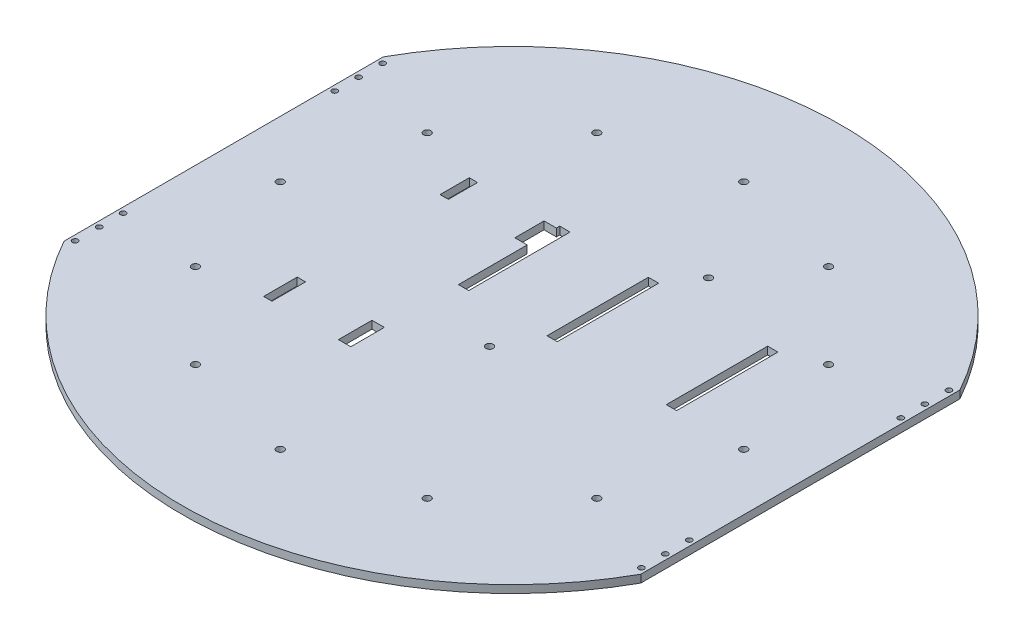
from build123d import *

# Parameters (mm, degrees)
BOSS_EXTRUDE1_DEPTH   = 4.7625
M3_CLEARANCE_HOLE1_D  = 3.4
F_8_CLEARANCE_HOLE1_D = 4.4958
CIRPATTERN1_COUNT     = 12
CUT_EXTRUDE1_REACH    = 272.048
SKETCH15_W            = 6.35
SKETCH15_H            = 62.484
SKETCH15_W_2          = 5.116657908
SKETCH15_H_2          = 18.000886741
SKETCH15_H_3          = 20.68418835
SKETCH15_W_3          = 7.62
CUT_EXTRUDE2_REACH    = 272.048
SKETCH17_R            = 2.2479


with BuildPart() as part:
    # Sketch1 → Boss-Extrude1 (new body)
    with BuildSketch(Plane(origin=(0, 0, 0), x_dir=(1, 0, 0), z_dir=(0, 1, 0))):
        with BuildLine():
            Line((177.8, 98.373776994), (177.8, -98.373776994))
            ThreePointArc((177.8, -98.373776994), (0, -203.2), (-177.8, -98.373776994))
            Line((-177.8, -98.373776994), (-177.8, 98.373776994))
            ThreePointArc((-177.8, 98.373776994), (0, 203.2), (177.8, 98.373776994))
        make_face()
    extrude(amount=BOSS_EXTRUDE1_DEPTH)

    # M3 Clearance Hole1 (through all)
    with Locations(Plane(origin=(0, 4.7625, 0), x_dir=(1, 0, 0), z_dir=(0, 1, 0))):
        with Locations((174.55, -94.8), (174.55, -80), (174.55, -65.2), (174.55, 65.2), (174.55, 80), (174.55, 94.8)):
            m3_clearance_hole1 = Hole(M3_CLEARANCE_HOLE1_D / 2)

    # Mirror1: M3 Clearance Hole1 across plane
    add(m3_clearance_hole1.mirror(Plane(origin=(0, 0, 0), x_dir=(0, 0, 1), z_dir=(1, 0, 0))), mode=Mode.SUBTRACT)

    # #8 Clearance Hole1 (through all)
    with Locations(Plane(origin=(0, 4.7625, 0), x_dir=(1, 0, 0), z_dir=(0, 1, 0))):
        with Locations((0, -142.875)):
            f_8_clearance_hole1 = Hole(F_8_CLEARANCE_HOLE1_D / 2)

    # CirPattern1: #8 Clearance Hole1 ×12 about axis
    cirpattern1_axis = Axis((0, 0, 0), (0, 1, 0))
    for i in range(1, CIRPATTERN1_COUNT):
        add(f_8_clearance_hole1.rotate(cirpattern1_axis, i * 360 / CIRPATTERN1_COUNT), mode=Mode.SUBTRACT)

    # Sketch15 → Cut-Extrude1 (cut, up to next)
    with BuildSketch(Plane(origin=(0, 4.7625, 0), x_dir=(1, 0, 0), z_dir=(0, 1, 0)), mode=Mode.PRIVATE) as cut_extrude1_sk1:
        with Locations((24.765, 31.242)):
            Rectangle(SKETCH15_W, SKETCH15_H)
    cut_extrude1_tool1 = extrude(cut_extrude1_sk1.sketch, amount=-CUT_EXTRUDE1_REACH, mode=Mode.PRIVATE) & part.part
    # Sketch15 → Cut-Extrude1 (cut, up to next)
    with BuildSketch(Plane(origin=(0, 4.7625, 0), x_dir=(1, 0, 0), z_dir=(0, 1, 0)), mode=Mode.PRIVATE) as cut_extrude1_sk2:
        Polygon((-26.67, 62.484), (-33.02, 62.484), (-33.02, 60.402879746), (-40.64, 60.402879746), (-40.64, 42.401993005), (-33.02, 42.401993005), (-33.02, 0), (-26.67, 0), align=None)
    cut_extrude1_tool2 = extrude(cut_extrude1_sk2.sketch, amount=-CUT_EXTRUDE1_REACH, mode=Mode.PRIVATE) & part.part
    # Sketch15 → Cut-Extrude1 (cut, up to next)
    with BuildSketch(Plane(origin=(0, 4.7625, 0), x_dir=(1, 0, 0), z_dir=(0, 1, 0)), mode=Mode.PRIVATE) as cut_extrude1_sk3:
        with Locations((98.3234, 31.242)):
            Rectangle(SKETCH15_W, SKETCH15_H)
    cut_extrude1_tool3 = extrude(cut_extrude1_sk3.sketch, amount=-CUT_EXTRUDE1_REACH, mode=Mode.PRIVATE) & part.part
    # Sketch15 → Cut-Extrude1 (cut, up to next)
    with BuildSketch(Plane(origin=(0, 4.7625, 0), x_dir=(1, 0, 0), z_dir=(0, 1, 0)), mode=Mode.PRIVATE) as cut_extrude1_sk4:
        with Locations((-84.198328954, 51.402436376)):
            Rectangle(SKETCH15_W_2, SKETCH15_H_2)
    cut_extrude1_tool4 = extrude(cut_extrude1_sk4.sketch, amount=-CUT_EXTRUDE1_REACH, mode=Mode.PRIVATE) & part.part
    # Sketch15 → Cut-Extrude1 (cut, up to next)
    with BuildSketch(Plane(origin=(0, 4.7625, 0), x_dir=(1, 0, 0), z_dir=(0, 1, 0)), mode=Mode.PRIVATE) as cut_extrude1_sk5:
        with Locations((-84.198328954, -56.013830848)):
            Rectangle(SKETCH15_W_2, SKETCH15_H_3)
    cut_extrude1_tool5 = extrude(cut_extrude1_sk5.sketch, amount=-CUT_EXTRUDE1_REACH, mode=Mode.PRIVATE) & part.part
    # Sketch15 → Cut-Extrude1 (cut, up to next)
    with BuildSketch(Plane(origin=(0, 4.7625, 0), x_dir=(1, 0, 0), z_dir=(0, 1, 0)), mode=Mode.PRIVATE) as cut_extrude1_sk6:
        with Locations((-36.83, -56.013830848)):
            Rectangle(SKETCH15_W_3, SKETCH15_H_3)
    cut_extrude1_tool6 = extrude(cut_extrude1_sk6.sketch, amount=-CUT_EXTRUDE1_REACH, mode=Mode.PRIVATE) & part.part
    add(cut_extrude1_tool1.solids().sort_by_distance((24.765, 4.7625, -31.242))[0], mode=Mode.SUBTRACT)
    add(cut_extrude1_tool2.solids().sort_by_distance((-31.639414, 4.7625, -36.421123))[0], mode=Mode.SUBTRACT)
    add(cut_extrude1_tool3.solids().sort_by_distance((98.3234, 4.7625, -31.242))[0], mode=Mode.SUBTRACT)
    add(cut_extrude1_tool4.solids().sort_by_distance((-84.198329, 4.7625, -51.402436))[0], mode=Mode.SUBTRACT)
    add(cut_extrude1_tool5.solids().sort_by_distance((-84.198329, 4.7625, 56.013831))[0], mode=Mode.SUBTRACT)
    add(cut_extrude1_tool6.solids().sort_by_distance((-36.83, 4.7625, 56.013831))[0], mode=Mode.SUBTRACT)

    # Sketch17 → Cut-Extrude2 (cut, up to next)
    with BuildSketch(Plane(origin=(0, 4.7625, 0), x_dir=(1, 0, 0), z_dir=(0, 1, 0)), mode=Mode.PRIVATE) as cut_extrude2_sk1:
        with Locations(Location((40.402766773, 80.728472273, 0), (0, 0, 270))):
            Circle(SKETCH17_R)
    cut_extrude2_tool1 = extrude(cut_extrude2_sk1.sketch, amount=-CUT_EXTRUDE2_REACH, mode=Mode.PRIVATE) & part.part
    # Sketch17 → Cut-Extrude2 (cut, up to next)
    with BuildSketch(Plane(origin=(0, 4.7625, 0), x_dir=(1, 0, 0), z_dir=(0, 1, 0)), mode=Mode.PRIVATE) as cut_extrude2_sk2:
        with Locations(Location((9.538335251, -23.376368086, 0), (0, 0, 270))):
            Circle(SKETCH17_R)
    cut_extrude2_tool2 = extrude(cut_extrude2_sk2.sketch, amount=-CUT_EXTRUDE2_REACH, mode=Mode.PRIVATE) & part.part
    add(cut_extrude2_tool1.solids().sort_by_distance((40.402767, 4.7625, -80.728472))[0], mode=Mode.SUBTRACT)
    add(cut_extrude2_tool2.solids().sort_by_distance((9.538335, 4.7625, 23.376368))[0], mode=Mode.SUBTRACT)


solid = part.part
